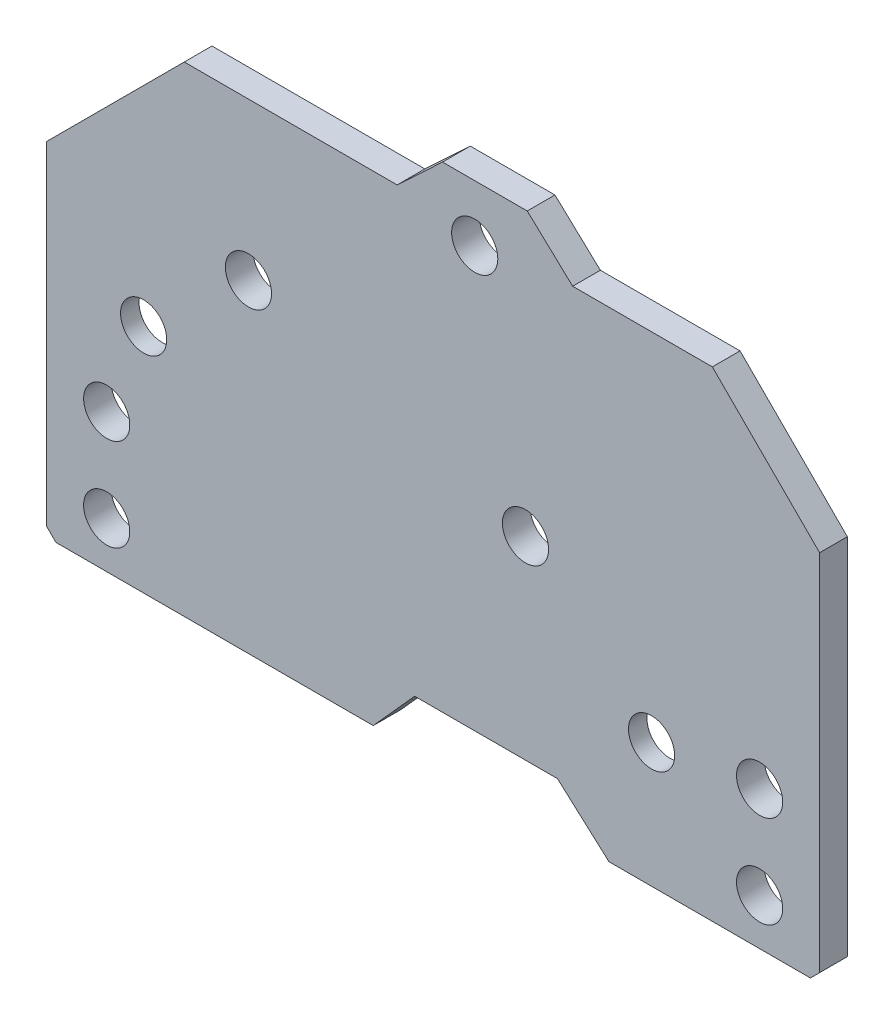
from build123d import *

# Parameters (mm, degrees)
SKETCH_1_R          = 5.2
SKETCH_1_R_2        = 2.5
EXTRUDE_1_DEPTH     = 3
EXTRUDE_START       = -2
SKETCH_3_R          = 5.2
SKETCH_3_R_2        = 2.5
EXTRUDE_3_DEPTH     = 2
SKETCH_7_R          = 2.5
CUT_EXTRUDE_1_DEPTH = 1
CUT_EXTRUDE_2_REACH = 53.662
SKETCH_9_R          = 2.5
CHAMFER_1_SIZE      = 1


with BuildPart() as part:
    # 스케치1 → 보스-돌출1 (new body)
    with BuildSketch(Plane.XY):
        Polygon((13.906175134, 23.803132686), (29.030703027, 23.803132686), (40.649680384, 12.184155329), (40.649680384, -28.196867314), (17.836321525, -28.196867314), (12.263074219, -23.196867314), (-3.200474103, -23.196867314), (-7.686189276, -28.196867314), (-43.049187557, -28.196867314), (-43.049187557, 8.903282862), (-28.149337734, 23.803132686), (-5.096572968, 23.803132686), (-0.180708362, 28.403132686), (8.990310529, 28.403132686), align=None)
        with Locations((22.449680384, -14.696867314)):
            Circle(SKETCH_1_R, mode=Mode.SUBTRACT)
        with Locations((-32.549187557, -3.196867314)):
            Circle(SKETCH_1_R, mode=Mode.SUBTRACT)
        with Locations((8.800246413, -2.196867314)):
            Circle(SKETCH_1_R_2, mode=Mode.SUBTRACT)
        with Locations((3.300246413, 22.303132686)):
            Circle(SKETCH_1_R_2, mode=Mode.SUBTRACT)
        with Locations((-21.199753587, 6.803132686)):
            Circle(SKETCH_1_R_2, mode=Mode.SUBTRACT)
    extrude(amount=EXTRUDE_1_DEPTH)

    # 스케치3 → 보스-돌출3 (add)
    # profile 1 of 2: a face of its own
    with BuildSketch(Plane.XY.offset(3).offset(EXTRUDE_START)):
        with Locations((-32.549187557, -3.196867314)):
            Circle(SKETCH_3_R)
        with Locations((-32.549187557, -3.196867314)):
            Circle(SKETCH_3_R_2, mode=Mode.SUBTRACT)
    # profile 2 of 2: a face of its own
    with BuildSketch(Plane.XY.offset(3).offset(EXTRUDE_START)):
        with Locations((22.449680384, -14.696867314)):
            Circle(SKETCH_3_R)
        with Locations((22.449680384, -14.696867314)):
            Circle(SKETCH_3_R_2, mode=Mode.SUBTRACT)
    extrude(amount=EXTRUDE_3_DEPTH)

    # 스케치7 → 컷-돌출1 (cut)
    with BuildSketch(Plane(origin=(0, 0, 0), x_dir=(-1, 0, 0), z_dir=(0, 0, -1))):
        with Locations((8.049187557, -24.196867314)):
            Circle(SKETCH_7_R)
        with Locations((6.149337734, 21.203132686)):
            Circle(SKETCH_7_R)
        with BuildLine():
            Line((-37.39408004, 7.870627017), (-37.39408004, 14.359426329))
            ThreePointArc((-37.39408004, 14.359426329), (-37.101186821, 15.066533111), (-36.39408004, 15.359426329))
            Line((-36.39408004, 15.359426329), (-33.149680384, 15.359426329))
            ThreePointArc((-33.149680384, 15.359426329), (-30.148436605, 14.116270452), (-28.905280727, 11.115026673))
            Line((-28.905280727, 11.115026673), (-28.905280727, 7.870627017))
            ThreePointArc((-28.905280727, 7.870627017), (-29.198173946, 7.163520236), (-29.905280727, 6.870627017))
            Line((-29.905280727, 6.870627017), (-36.39408004, 6.870627017))
            ThreePointArc((-36.39408004, 6.870627017), (-37.101186821, 7.163520236), (-37.39408004, 7.870627017))
        make_face()
    extrude(amount=-CUT_EXTRUDE_1_DEPTH, mode=Mode.SUBTRACT)

    # 스케치9 → 컷-돌출2 (cut, up to next)
    with BuildSketch(Plane(origin=(0, 0, 0), x_dir=(-1, 0, 0), z_dir=(0, 0, -1)), mode=Mode.PRIVATE) as cut_extrude_2_sk1:
        with Locations((-34.149680384, -13.196867314)):
            Circle(SKETCH_9_R)
    cut_extrude_2_tool1 = extrude(cut_extrude_2_sk1.sketch, amount=-CUT_EXTRUDE_2_REACH, mode=Mode.PRIVATE) & part.part
    # 스케치9 → 컷-돌출2 (cut, up to next)
    with BuildSketch(Plane(origin=(0, 0, 0), x_dir=(-1, 0, 0), z_dir=(0, 0, -1)), mode=Mode.PRIVATE) as cut_extrude_2_sk2:
        with Locations((-34.149680384, -23.196867314)):
            Circle(SKETCH_9_R)
    cut_extrude_2_tool2 = extrude(cut_extrude_2_sk2.sketch, amount=-CUT_EXTRUDE_2_REACH, mode=Mode.PRIVATE) & part.part
    # 스케치9 → 컷-돌출2 (cut, up to next)
    with BuildSketch(Plane(origin=(0, 0, 0), x_dir=(-1, 0, 0), z_dir=(0, 0, -1)), mode=Mode.PRIVATE) as cut_extrude_2_sk3:
        with Locations((36.549187557, -13.196867314)):
            Circle(SKETCH_9_R)
    cut_extrude_2_tool3 = extrude(cut_extrude_2_sk3.sketch, amount=-CUT_EXTRUDE_2_REACH, mode=Mode.PRIVATE) & part.part
    # 스케치9 → 컷-돌출2 (cut, up to next)
    with BuildSketch(Plane(origin=(0, 0, 0), x_dir=(-1, 0, 0), z_dir=(0, 0, -1)), mode=Mode.PRIVATE) as cut_extrude_2_sk4:
        with Locations((36.549187557, -23.196867314)):
            Circle(SKETCH_9_R)
    cut_extrude_2_tool4 = extrude(cut_extrude_2_sk4.sketch, amount=-CUT_EXTRUDE_2_REACH, mode=Mode.PRIVATE) & part.part
    add(cut_extrude_2_tool1.solids().sort_by_distance((34.14968, -13.196867, 0))[0], mode=Mode.SUBTRACT)
    add(cut_extrude_2_tool2.solids().sort_by_distance((34.14968, -23.196867, 0))[0], mode=Mode.SUBTRACT)
    add(cut_extrude_2_tool3.solids().sort_by_distance((-36.549188, -13.196867, 0))[0], mode=Mode.SUBTRACT)
    add(cut_extrude_2_tool4.solids().sort_by_distance((-36.549188, -23.196867, 0))[0], mode=Mode.SUBTRACT)

    # 모따기1
    chamfer_1_edges = [part.edges().sort_by_distance(p)[0] for p in [
        (40.649680384, -28.196867314, 1.5),
        (-43.049187557, -28.196867314, 1.5),
    ]]
    chamfer(chamfer_1_edges, length=CHAMFER_1_SIZE)


solid = part.part
